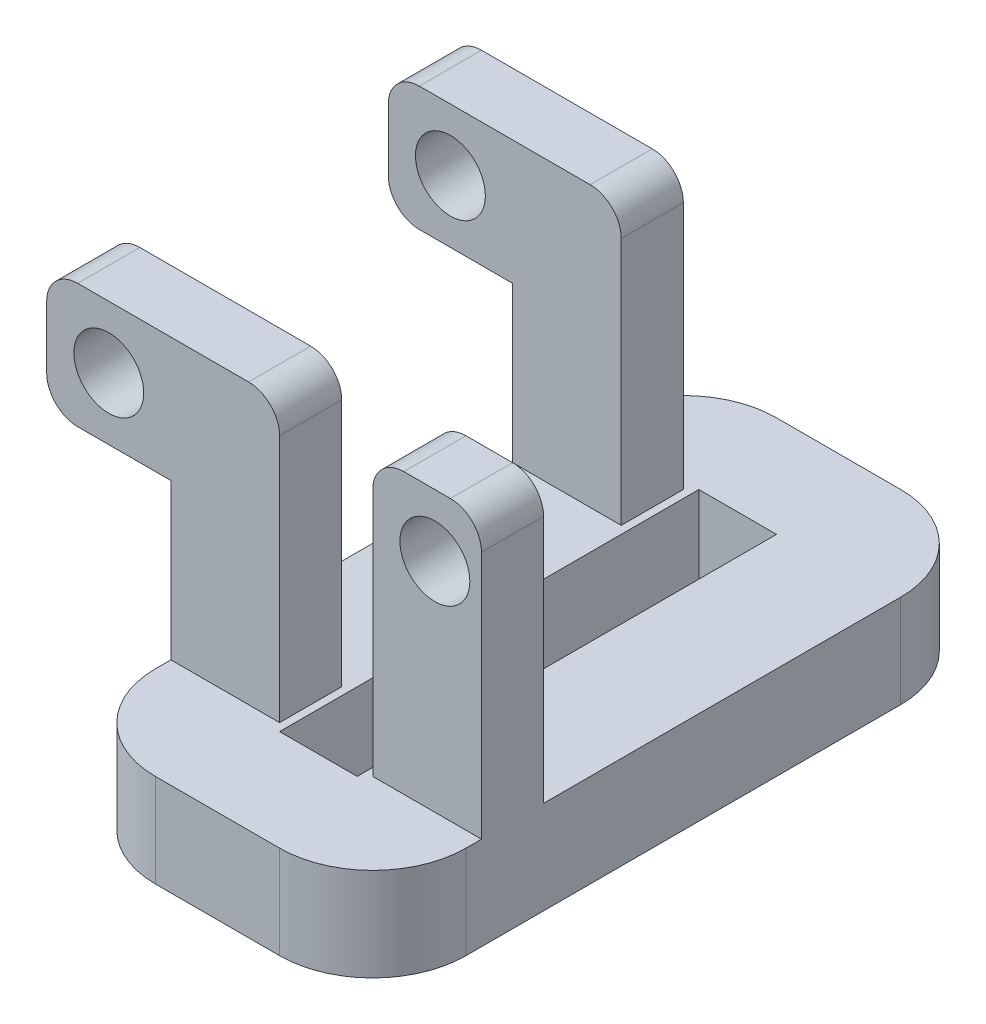
from build123d import *

# Parameters (mm, degrees)
CROQUIS1_W              = 2.5
CROQUIS1_H              = 13.5
SALIENTE_EXTRUIR1_DEPTH = 3
CROQUIS2_W              = 3.5
CROQUIS2_H              = 2
SALIENTE_EXTRUIR2_DEPTH = 9
CROQUIS3_R              = 1.125
CORTAR_EXTRUIR1_DEPTH   = 13
CROQUIS5_W              = 2
CROQUIS5_H              = 4
SALIENTE_EXTRUIR3_DEPTH = 4
CROQUIS6_R              = 1.125
CORTAR_EXTRUIR3_DEPTH   = 23.299103121
REDONDEO2_R             = 1


with BuildPart() as part:
    # Croquis1 → Saliente-Extruir1 (new body)
    with BuildSketch(Plane(origin=(0, 0, 0), x_dir=(1, 0, 0), z_dir=(0, 1, 0))):
        with BuildLine():
            Line((-2, -10), (2, -10))
            ThreePointArc((2, -10), (4.121320344, -9.121320344), (5, -7))
            Line((5, -7), (5, 7))
            ThreePointArc((5, 7), (4.121320344, 9.121320344), (2, 10))
            Line((2, 10), (-2, 10))
            ThreePointArc((-2, 10), (-4.121320344, 9.121320344), (-5, 7))
            Line((-5, 7), (-5, -7))
            ThreePointArc((-5, -7), (-4.121320344, -9.121320344), (-2, -10))
        make_face()
        Rectangle(CROQUIS1_W, CROQUIS1_H, mode=Mode.SUBTRACT)
    extrude(amount=SALIENTE_EXTRUIR1_DEPTH)

    # Croquis2 → Saliente-Extruir2 (add)
    with BuildSketch(Plane(origin=(0, 3, 0), x_dir=(1, 0, 0), z_dir=(0, 1, 0))):
        with Locations((-3.25, 5.5)):
            Rectangle(CROQUIS2_W, CROQUIS2_H)
        with Locations((-3.25, -5.5)):
            Rectangle(CROQUIS2_W, CROQUIS2_H)
        with Locations((3.25, -5.5)):
            Rectangle(CROQUIS2_W, CROQUIS2_H)
    extrude(amount=SALIENTE_EXTRUIR2_DEPTH)

    # Croquis3 → Cortar-Extruir1 (cut)
    with BuildSketch(Plane.XY.offset(6.5)):
        with Locations((3.5, 10)):
            Circle(CROQUIS3_R)
    extrude(amount=-CORTAR_EXTRUIR1_DEPTH, mode=Mode.SUBTRACT)

    # Croquis5 → Saliente-Extruir3 (add)
    with BuildSketch(Plane.ZY.offset(5)):
        with Locations((5.5, 10)):
            Rectangle(CROQUIS5_W, CROQUIS5_H)
        with Locations((-5.5, 10)):
            Rectangle(CROQUIS5_W, CROQUIS5_H)
    extrude(amount=SALIENTE_EXTRUIR3_DEPTH)

    # Croquis6 → Cortar-Extruir3 (cut, through all)
    with BuildSketch(Plane.XY.offset(6.5)):
        with Locations((-7, 10)):
            Circle(CROQUIS6_R)
    extrude(amount=-CORTAR_EXTRUIR3_DEPTH, mode=Mode.SUBTRACT)

    # Redondeo2
    redondeo2_edges = [part.edges().sort_by_distance(p)[0] for p in [
        (-1.5, 12, -5.5),
        (-1.5, 12, 5.5),
        (1.5, 12, 5.5),
        (5, 12, 5.5),
        (-9, 8, 5.5),
        (-9, 12, 5.5),
        (-9, 12, -5.5),
        (-9, 8, -5.5),
    ]]
    fillet(redondeo2_edges, radius=REDONDEO2_R)


solid = part.part
